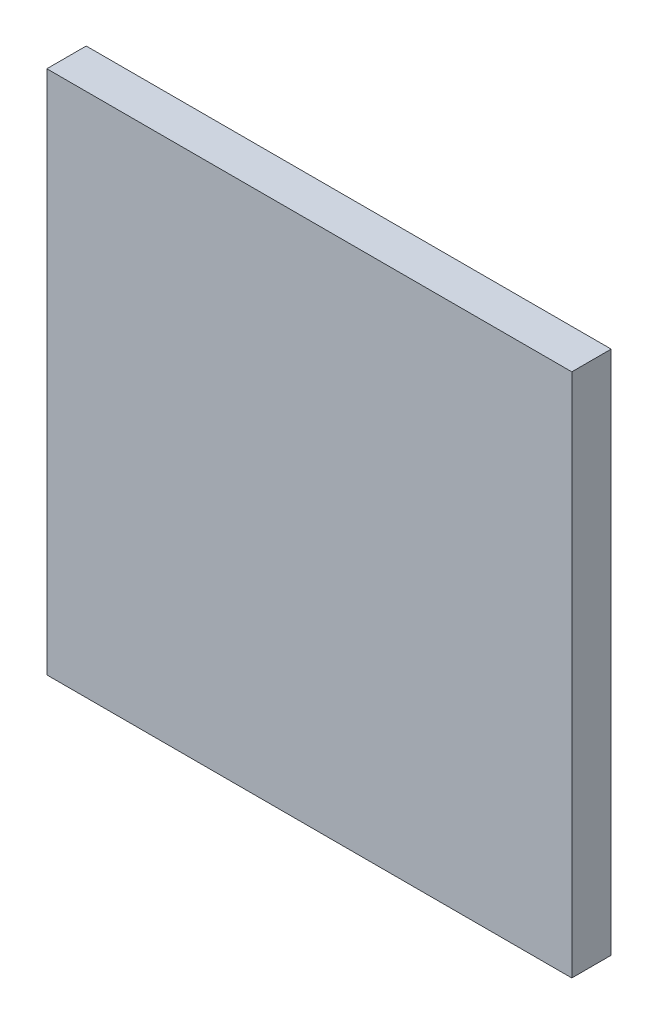
from build123d import *

# Parameters (mm, degrees)
SKETCH1_W               = 13.9999974
SKETCH1_H               = 13.9999974
COMPONENT_OUTLINE_DEPTH = 1.0500106


with BuildPart() as part:
    # Sketch1 → Component_Outline (new body)
    with BuildSketch(Plane.XY):
        with Locations((1.27e-05, -1.27e-05)):
            Rectangle(SKETCH1_W, SKETCH1_H)
    extrude(amount=COMPONENT_OUTLINE_DEPTH)


solid = part.part
